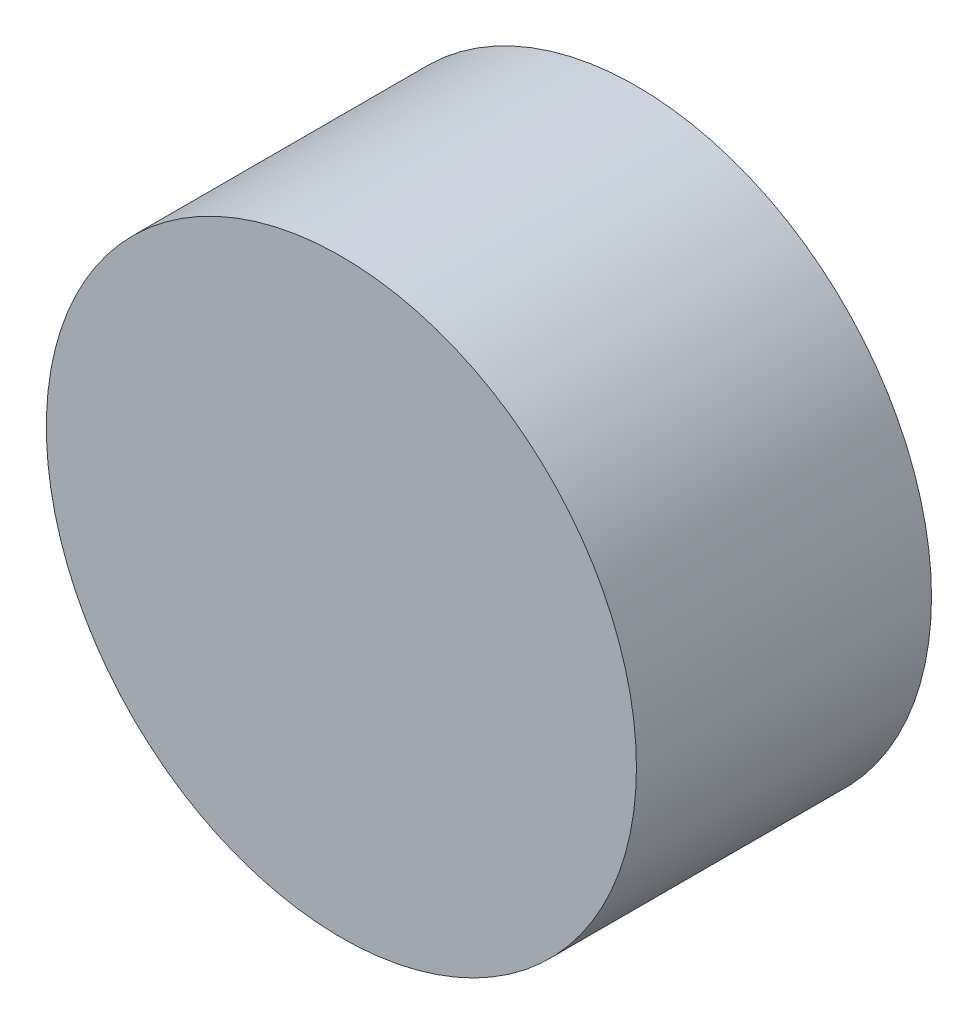
from build123d import *

# Parameters (mm, degrees)
SKETCH_1_R      = 4
EXTRUDE_1_DEPTH = 4


with BuildPart() as part:
    # 草图1 → 凸台-拉伸1 (new body)
    with BuildSketch(Plane.XY):
        with Locations((-8.412089723, 9.413528976)):
            Circle(SKETCH_1_R)
    extrude(amount=EXTRUDE_1_DEPTH)


solid = part.part
